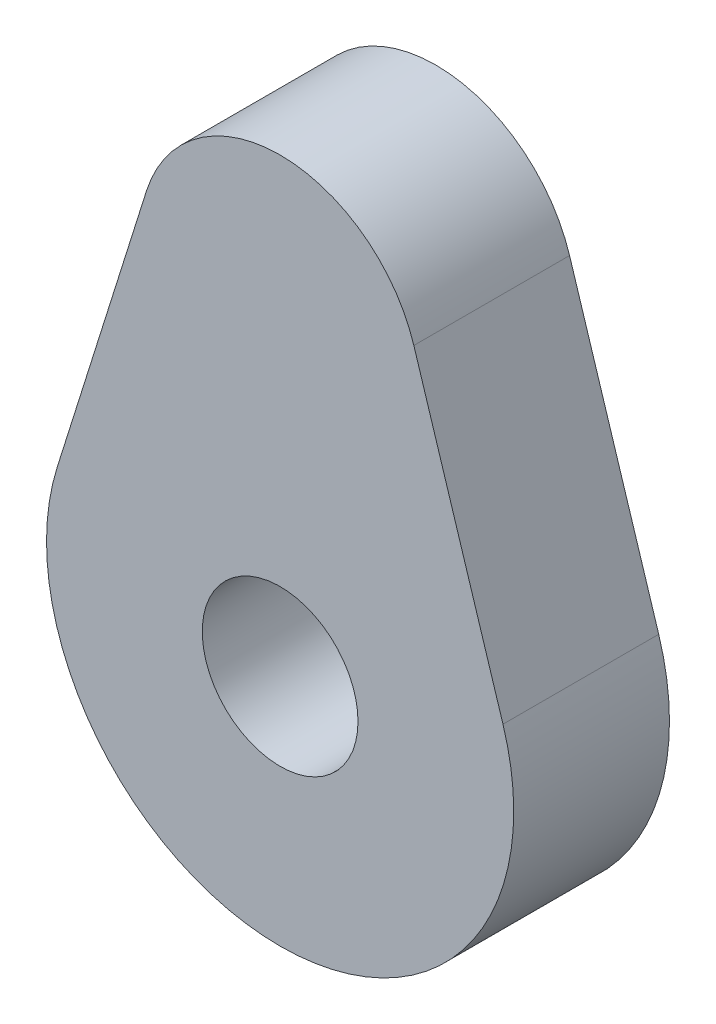
from build123d import *

# Parameters (mm, degrees)
SKETCH1_R           = 12.7
BOSS_EXTRUDE1_DEPTH = 25.4


with BuildPart() as part:
    # Sketch1 → Boss-Extrude1 (new body)
    with BuildSketch(Plane.XY):
        with BuildLine():
            Line((-21.807050144, 57.658), (-36.345083574, 11.43))
            ThreePointArc((-36.345083574, 11.43), (0, -38.1), (36.345083574, 11.43))
            Line((36.345083574, 11.43), (21.807050144, 57.658))
            ThreePointArc((21.807050144, 57.658), (0, 73.66), (-21.807050144, 57.658))
        make_face()
        Circle(SKETCH1_R, mode=Mode.SUBTRACT)
    extrude(amount=BOSS_EXTRUDE1_DEPTH)


solid = part.part
